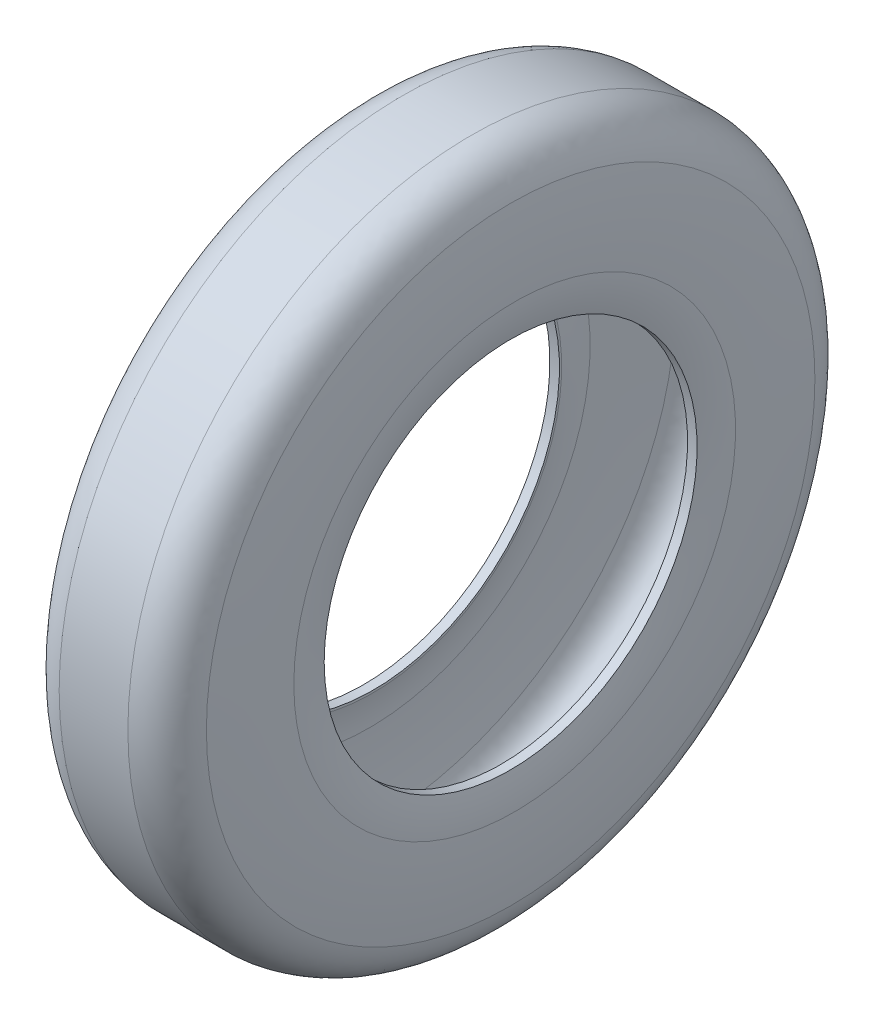
from build123d import *


with BuildPart() as part:
    # Çizim2 → Döndür2 (revolve)
    with BuildSketch(Plane.XY, mode=Mode.PRIVATE) as d_nd_r2_sk:
        with BuildLine():
            Line((-17.5, 175), (17.5, 175))
            add(Edge.make_bspline(
                [(37.5, 155), (33.180831077, 172.735676283), (17.5, 175)],
                knots=[0, 0, 0, 1, 1, 1], degree=2))
            add(Edge.make_bspline(
                [(39.558004611, 112.515379933), (40.037526358, 133.823558291), (37.5, 155)],
                knots=[0, 0, 0, 1, 1, 1], degree=2))
            add(Edge.make_bspline(
                [(37.5, 95), (39.553838697, 103.632489558), (39.558004611, 112.515379933)],
                knots=[0, 0, 0, 1, 1, 1], degree=2))
            Line((37.5, 95), (32.635776521, 95))
            Line((32.635776521, 95), (32.635776521, 96.157294236))
            add(Edge.make_bspline(
                [(34.558030993, 112.572805408), (34.560206153, 104.242772286), (32.635776521, 96.157294236)],
                knots=[0, 0, 0, 1.003100374, 1.003100374, 1.003100374], degree=2))
            add(Edge.make_bspline(
                [(32.571883188, 154.100277592), (35.030598816, 133.401140869), (34.558030993, 112.572805408)],
                knots=[-0.001292148, -0.001292148, -0.001292148, 0.992681429, 0.992681429, 0.992681429], degree=2))
            add(Edge.make_bspline(
                [(17.124055566, 170), (19.474259763, 169.620198998), (23.300690577, 168.10451916), (26.942501614, 165.499652433), (29.8373746, 161.506356907), (31.847105471, 156.962883589), (32.571883188, 154.100277592)],
                knots=[0.00902413, 0.00902413, 0.00902413, 0.192379486, 0.375734842, 0.620208649, 0.803564005, 0.986919361, 0.986919361, 0.986919361], degree=2))
            Line((17.124055566, 170), (-17.124055566, 170))
            add(Edge.make_bspline(
                [(-32.571883188, 154.100277592), (-31.847105471, 156.962883589), (-29.8373746, 161.506356907), (-26.942501614, 165.499652433), (-23.300690577, 168.10451916), (-19.474259763, 169.620198998), (-17.124055566, 170)],
                knots=[0.00902413, 0.00902413, 0.00902413, 0.192379486, 0.375734842, 0.620208649, 0.803564005, 0.986919361, 0.986919361, 0.986919361], degree=2))
            add(Edge.make_bspline(
                [(-34.558030993, 112.572805408), (-35.030598816, 133.401140869), (-32.571883188, 154.100277592)],
                knots=[-0.001292148, -0.001292148, -0.001292148, 0.992681429, 0.992681429, 0.992681429], degree=2))
            add(Edge.make_bspline(
                [(-32.635776521, 96.157294236), (-34.560206153, 104.242772286), (-34.558030993, 112.572805408)],
                knots=[0, 0, 0, 1.003100374, 1.003100374, 1.003100374], degree=2))
            Line((-32.635776521, 96.157294236), (-32.635776521, 95))
            Line((-32.635776521, 95), (-37.5, 95))
            add(Edge.make_bspline(
                [(-37.5, 95), (-39.553838697, 103.632489558), (-39.558004611, 112.515379933)],
                knots=[0, 0, 0, 1, 1, 1], degree=2))
            add(Edge.make_bspline(
                [(-39.558004611, 112.515379933), (-40.037526358, 133.823558291), (-37.5, 155)],
                knots=[0, 0, 0, 1, 1, 1], degree=2))
            add(Edge.make_bspline(
                [(-37.5, 155), (-33.180831077, 172.735676283), (-17.5, 175)],
                knots=[0, 0, 0, 1, 1, 1], degree=2))
        make_face()
    revolve(d_nd_r2_sk.sketch.rotate(Axis((-171.693896407, 0, 0), (1, 0, 0)), 90), axis=Axis((-171.693896407, 0, 0), (1, 0, 0)))


solid = part.part
